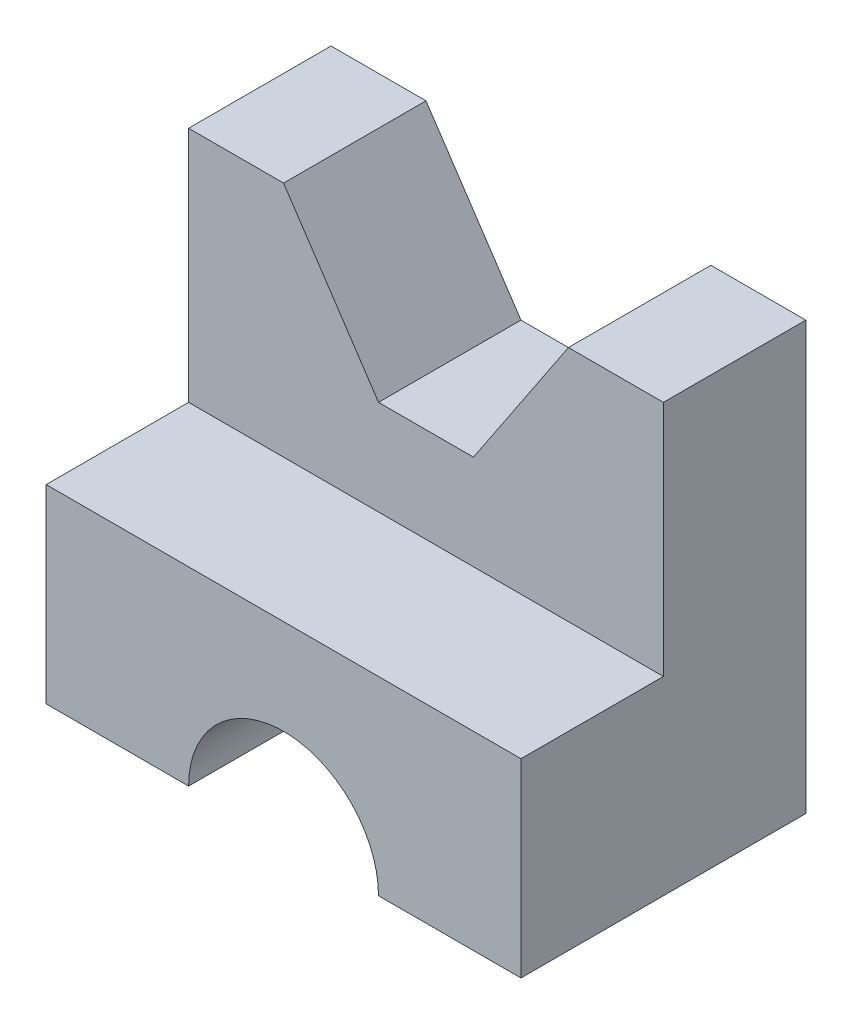
from build123d import *

# Parameters (mm, degrees)
SALIENTE_EXTRUIR1_DEPTH = 25
CORTAR_EXTRUIR2_REACH   = 61.582


with BuildPart() as part:
    # Croquis2 → Saliente-Extruir1 (new, symmetric)
    with BuildSketch(Plane(origin=(0, 0, 0), x_dir=(0, 0, -1), z_dir=(1, 0, 0))):
        Polygon((0, 0), (0, 45), (-15, 45), (-15, 20), (-30, 20), (-30, 0), align=None)
    extrude(amount=SALIENTE_EXTRUIR1_DEPTH, both=True)

    # Croquis4 → Cortar-Extruir2 (cut, up to next)
    with BuildSketch(Plane.XY, mode=Mode.PRIVATE) as cortar_extruir2_sk1:
        with BuildLine():
            Line((-10, 0), (10, 0))
            ThreePointArc((10, 0), (0, 10), (-10, 0))
        make_face()
    cortar_extruir2_tool1 = extrude(cortar_extruir2_sk1.sketch, amount=CORTAR_EXTRUIR2_REACH, mode=Mode.PRIVATE) & part.part
    # Croquis4 → Cortar-Extruir2 (cut, up to next)
    with BuildSketch(Plane.XY, mode=Mode.PRIVATE) as cortar_extruir2_sk2:
        Polygon((-15, 45), (-5, 30), (5, 30), (15, 45), align=None)
    cortar_extruir2_tool2 = extrude(cortar_extruir2_sk2.sketch, amount=CORTAR_EXTRUIR2_REACH, mode=Mode.PRIVATE) & part.part
    add(cortar_extruir2_tool1.solids().sort_by_distance((0, 4.244132, 0))[0], mode=Mode.SUBTRACT)
    add(cortar_extruir2_tool2.solids().sort_by_distance((0, 38.75, 0))[0], mode=Mode.SUBTRACT)


solid = part.part
